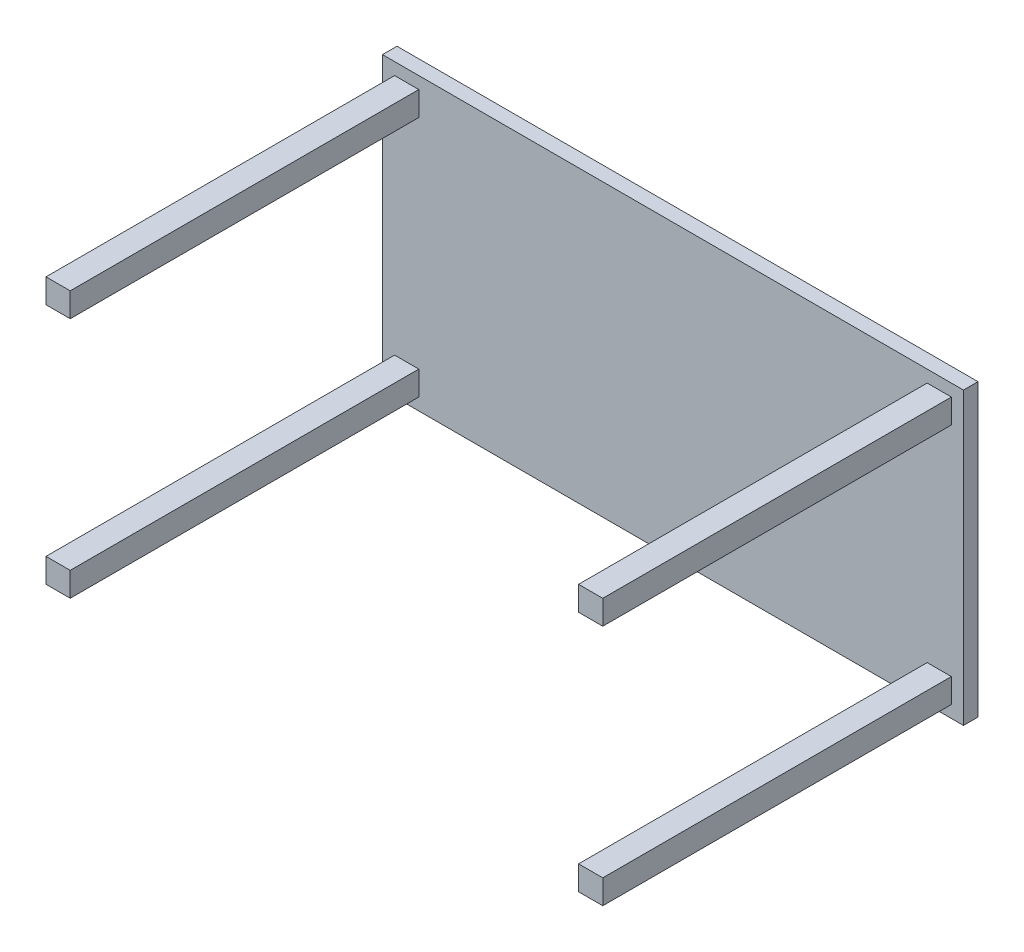
from build123d import *

# Parameters (mm, degrees)
SKETCH_1_W      = 1200
SKETCH_1_H      = 600
EXTRUDE_1_DEPTH = 30
SKETCH_2_W      = 50
SKETCH_2_H      = 50
EXTRUDE_2_DEPTH = 750
SKETCH_3_W      = 50
SKETCH_3_H      = 50
EXTRUDE_3_DEPTH = 750
SKETCH_4_W      = 50
SKETCH_4_H      = 50
EXTRUDE_4_DEPTH = 750
SKETCH_5_W      = 50
SKETCH_5_H      = 50
EXTRUDE_5_DEPTH = 750


with BuildPart() as part:
    # 草图1 → 凸台-拉伸1 (new body)
    with BuildSketch(Plane.XY):
        Rectangle(SKETCH_1_W, SKETCH_1_H)
    extrude(amount=EXTRUDE_1_DEPTH)

    # 草图2 → 凸台-拉伸2 (add)
    with BuildSketch(Plane.XY):
        with Locations((-550, -250)):
            Rectangle(SKETCH_2_W, SKETCH_2_H)
    extrude(amount=EXTRUDE_2_DEPTH)

    # 草图3 → 凸台-拉伸3 (add)
    with BuildSketch(Plane.XY):
        with Locations((550, -250)):
            Rectangle(SKETCH_3_W, SKETCH_3_H)
    extrude(amount=EXTRUDE_3_DEPTH)

    # 草图4 → 凸台-拉伸4 (add)
    with BuildSketch(Plane.XY):
        with Locations((-550, 250)):
            Rectangle(SKETCH_4_W, SKETCH_4_H)
    extrude(amount=EXTRUDE_4_DEPTH)

    # 草图5 → 凸台-拉伸5 (add)
    with BuildSketch(Plane.XY):
        with Locations((550, 250)):
            Rectangle(SKETCH_5_W, SKETCH_5_H)
    extrude(amount=EXTRUDE_5_DEPTH)


solid = part.part
